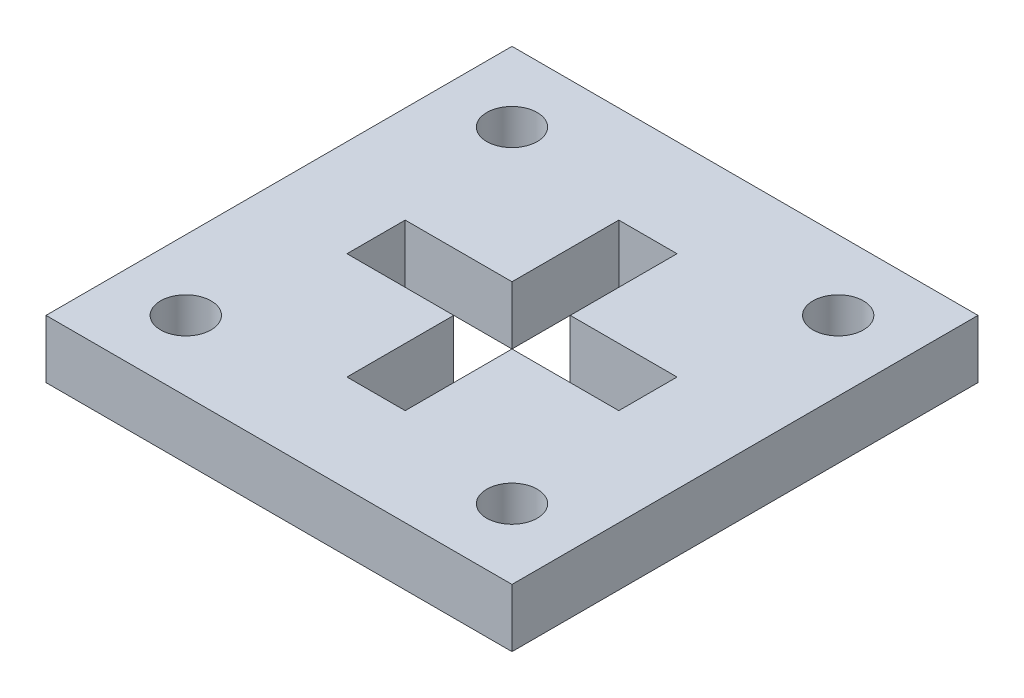
from build123d import *

# Parameters (mm, degrees)
SKETCH1_W            = 50.8
SKETCH1_H            = 50.8
BOSS_EXTRUDE1_DEPTH  = 6.35
CUT_EXTRUDE1_DEPTH   = 6.35
M5_CLEARANCE_HOLE1_D = 5.5


with BuildPart() as part:
    # Sketch1 → Boss-Extrude1 (new body)
    with BuildSketch(Plane(origin=(0, 0, 0), x_dir=(1, 0, 0), z_dir=(0, 1, 0))):
        with Locations((25.4, 25.4)):
            Rectangle(SKETCH1_W, SKETCH1_H)
    extrude(amount=BOSS_EXTRUDE1_DEPTH)

    # Sketch2 → Cut-Extrude1 (cut)
    with BuildSketch(Plane(origin=(0, 6.35, 0), x_dir=(1, 0, 0), z_dir=(0, 1, 0))):
        Polygon((28.575, 28.575), (40.216666667, 28.575), (40.216666667, 22.225), (28.575, 22.225), (28.575, 10.583333333), (22.225, 10.583333333), (22.225, 22.225), (10.583333333, 22.225), (10.583333333, 28.575), (22.225, 28.575), (22.225, 40.216666667), (28.575, 40.216666667), align=None)
    extrude(amount=-CUT_EXTRUDE1_DEPTH, mode=Mode.SUBTRACT)

    # M5 Clearance Hole1 (through all)
    with Locations(Plane(origin=(0, 6.35, 0), x_dir=(1, 0, 0), z_dir=(0, 1, 0))):
        with Locations((7.62, 43.18), (43.18, 43.18), (43.18, 7.62), (7.62, 7.62)):
            Hole(M5_CLEARANCE_HOLE1_D / 2)


solid = part.part
